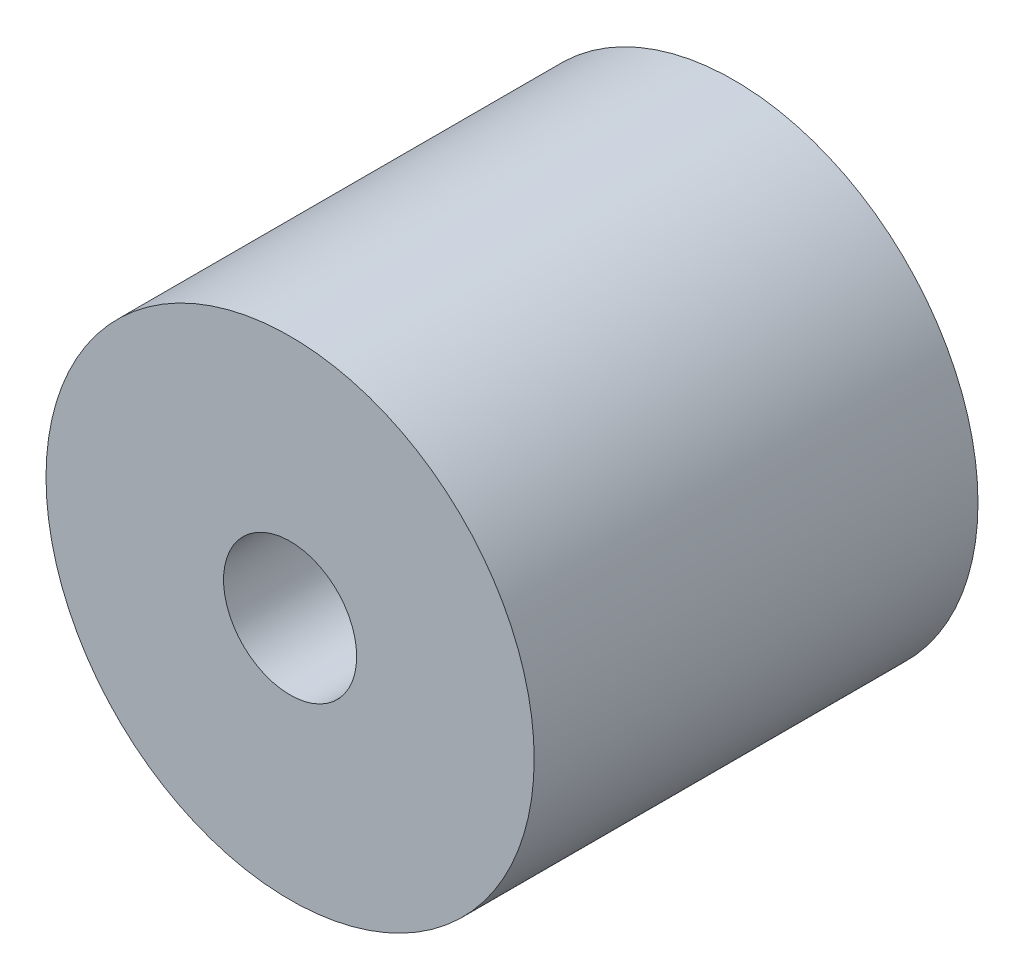
from build123d import *

# Parameters (mm, degrees)
SKETCH1_R           = 5.5
SKETCH1_R_2         = 1.5
BOSS_EXTRUDE1_DEPTH = 10


with BuildPart() as part:
    # Sketch1 → Boss-Extrude1 (new body)
    with BuildSketch(Plane.XY):
        Circle(SKETCH1_R)
        Circle(SKETCH1_R_2, mode=Mode.SUBTRACT)
    extrude(amount=BOSS_EXTRUDE1_DEPTH)


solid = part.part
